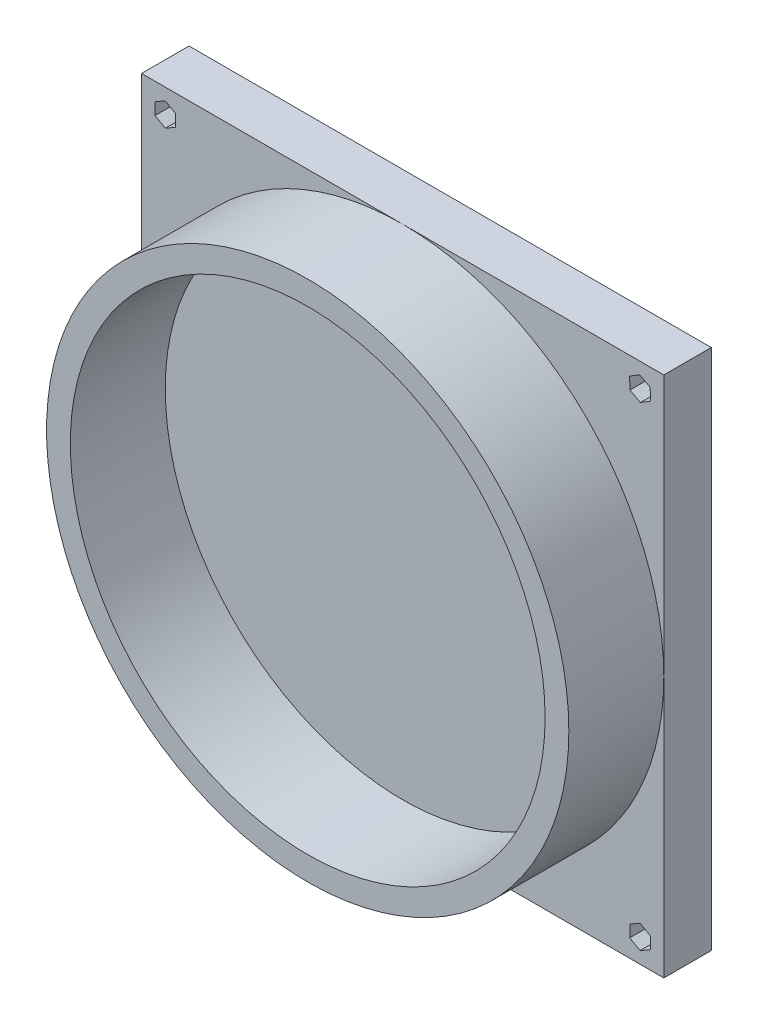
from build123d import *

# Parameters (mm, degrees)
SKETCH2_R           = 55
BOSS_EXTRUDE2_DEPTH = 30
SKETCH5_R           = 50
CUT_EXTRUDE2_DEPTH  = 21
SKETCH6_W           = 110
SKETCH6_H           = 110
BOSS_EXTRUDE3_DEPTH = 10
CUT_EXTRUDE5_DEPTH  = 23


with BuildPart() as part:
    # Sketch2 → Boss-Extrude2 (new body)
    with BuildSketch(Plane.XY):
        Circle(SKETCH2_R)
    extrude(amount=BOSS_EXTRUDE2_DEPTH)

    # Sketch5 → Cut-Extrude2 (cut)
    with BuildSketch(Plane.XY.offset(30)):
        Circle(SKETCH5_R)
    extrude(amount=-CUT_EXTRUDE2_DEPTH, mode=Mode.SUBTRACT)

    # Sketch6 → Boss-Extrude3 (add)
    with BuildSketch(Plane.XY):
        Rectangle(SKETCH6_W, SKETCH6_H)
    extrude(amount=BOSS_EXTRUDE3_DEPTH)

    # Sketch7 → Cut-Extrude5 (cut)
    with BuildSketch(Plane.XY):
        Polygon((-47.826827432, 48.764151713), (-47.843137704, 51.264098507), (-50.016310272, 52.499946794), (-52.173172568, 51.235848287), (-52.156862296, 48.735901493), (-49.983689728, 47.500053206), align=None)
        Polygon((50.080599261, 47.501299586), (52.204237665, 48.8204508), (52.123638405, 51.319151214), (49.919400739, 52.498700414), (47.795762335, 51.1795492), (47.876361595, 48.680848786), align=None)
        Polygon((52.165063509, -51.25), (52.165063509, -48.75), (50, -47.5), (47.834936491, -48.75), (47.834936491, -51.25), (50, -52.5), align=None)
        Polygon((-49.98483432, -52.499954), (-47.827393488, -51.236843136), (-47.842559168, -48.736889136), (-50.01516568, -47.500046), (-52.172606512, -48.763156864), (-52.157440832, -51.263110864), align=None)
    extrude(amount=CUT_EXTRUDE5_DEPTH, mode=Mode.SUBTRACT)


solid = part.part
